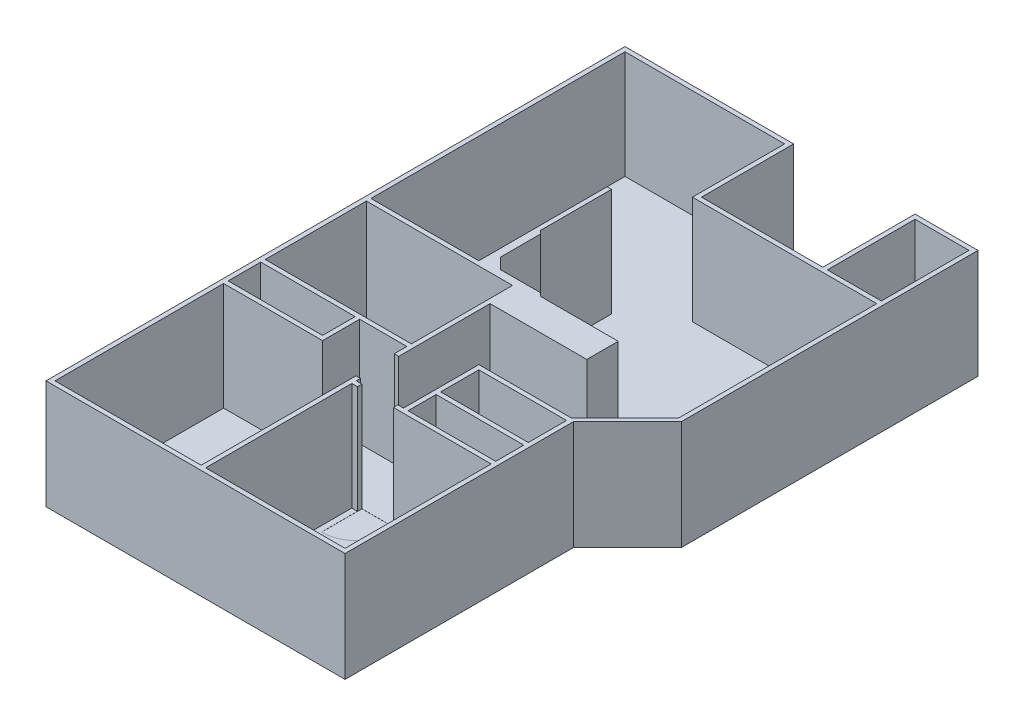
from build123d import *

# Parameters (mm, degrees)
SKETCH1_W           = 3149.6
SKETCH1_H           = 3302
SKETCH1_W_2         = 1981.2
SKETCH1_H_2         = 635
SKETCH1_H_3         = 863.6
SKETCH1_W_3         = 2133.6
SKETCH1_H_4         = 736.6
SKETCH1_W_4         = 1219.2
SKETCH1_H_5         = 1981.2
BOSS_EXTRUDE2_DEPTH = 2438.4
BOSS_EXTRUDE3_DEPTH = 25.4
CUT_EXTRUDE1_DEPTH  = 2440.94
CUT_EXTRUDE2_DEPTH  = 1168.4
SKETCH4_R           = 127
BOSS_EXTRUDE4_DEPTH = 914.4


with BuildPart() as part:
    # Sketch1 → Boss-Extrude2 (new body)
    with BuildSketch(Plane(origin=(0, 0, 0), x_dir=(1, 0, 0), z_dir=(0, 1, 0))):
        Polygon((6451.6, 10896.6), (3708.4, 10896.6), (3708.4, 12979.4), (-101.6, 12979.4), (-101.6, -101.6), (6654.8, -101.6), (6654.8, 5063.315902063), (7874, 6282.515902063), (7874, 12979.4), (6451.6, 12979.4), align=None)
        Polygon((3833.156881434, 7137.4), (2540, 8430.556881434), (2540, 10033), (2438.4, 10033), (2438.4, 7137.4), (0, 7137.4), (0, 12877.8), (3606.8, 12877.8), (3606.8, 10795), (7772.4, 10795), (7772.4, 6324.6), (6553.2, 5105.4), (4470.4, 5105.4), (4470.4, 3403.6), (3403.6, 3403.6), (3403.6, 3499.213082822), (3302, 3499.213082822), (3302, 0), (0, 0), (0, 3810), (2235.2, 3810), (2235.2, 4648.2), (3302, 4648.2), (3302, 4362.813082822), (3403.6, 4362.813082822), (3403.6, 6426.2), (5588, 6426.2), (5588, 7137.4), align=None, mode=Mode.SUBTRACT)
        Polygon((3302, 6426.2), (3302, 4749.8), (0, 4749.8), (0, 7035.8), (3302, 7035.8), align=None, mode=Mode.SUBTRACT)
        with Locations((4978.4, 1651)):
            Rectangle(SKETCH1_W, SKETCH1_H, mode=Mode.SUBTRACT)
        with Locations((5562.6, 3721.1)):
            Rectangle(SKETCH1_W_2, SKETCH1_H_2, mode=Mode.SUBTRACT)
        with Locations((5562.6, 4572)):
            Rectangle(SKETCH1_W_2, SKETCH1_H_3, mode=Mode.SUBTRACT)
        with Locations((1066.8, 4279.9)):
            Rectangle(SKETCH1_W_3, SKETCH1_H_4, mode=Mode.SUBTRACT)
        with Locations((7162.8, 11887.2)):
            Rectangle(SKETCH1_W_4, SKETCH1_H_5, mode=Mode.SUBTRACT)
    extrude(amount=BOSS_EXTRUDE2_DEPTH)

    # Sketch1<5> → Boss-Extrude3 (add)
    with BuildSketch(Plane(origin=(0, 0, 0), x_dir=(1, 0, 0), z_dir=(0, 1, 0))):
        Polygon((3708.4, 12979.4), (-101.6, 12979.4), (-101.6, -101.6), (6654.8, -101.6), (6654.8, 5063.315902063), (7874, 6282.515902063), (7874, 12979.4), (6451.6, 12979.4), (6451.6, 13335), (3708.4, 13335), align=None)
    extrude(amount=-BOSS_EXTRUDE3_DEPTH)

    # Sketch2 → Cut-Extrude1 (cut)
    with BuildSketch(Plane(origin=(0, 2438.4, 0), x_dir=(1, 0, 0), z_dir=(0, 1, 0))):
        with BuildLine():
            Line((3530.6, 3403.6), (3530.6, 3302))
            Line((3530.6, 3302), (3530.6, 2489.2))
            ThreePointArc((3530.6, 2489.2), (4105.336391748, 2727.263608252), (4343.4, 3302))
            Line((4343.4, 3302), (4343.4, 3403.6))
            Line((4343.4, 3403.6), (3530.6, 3403.6))
        make_face()
    extrude(amount=-CUT_EXTRUDE1_DEPTH, mode=Mode.SUBTRACT)

    # Sketch3 → Cut-Extrude2 (cut)
    with BuildSketch(Plane(origin=(0, 2438.4, 0), x_dir=(1, 0, 0), z_dir=(0, 1, 0))):
        Polygon((2611.842048969, 8358.714832465), (2611.842048969, 7457.014832465), (2859.614832465, 7209.242048969), (3761.314832465, 7209.242048969), align=None)
    extrude(amount=-CUT_EXTRUDE2_DEPTH, mode=Mode.SUBTRACT)

    # Sketch4 → Boss-Extrude4 (add)
    with BuildSketch(Plane(origin=(0, 0, 0), x_dir=(1, 0, 0), z_dir=(0, 1, 0))):
        with Locations(Location((7295.970143414, 10488.35135806, 0), (0, 0, 270))):
            Circle(SKETCH4_R)
    extrude(amount=BOSS_EXTRUDE4_DEPTH)


solid = part.part
